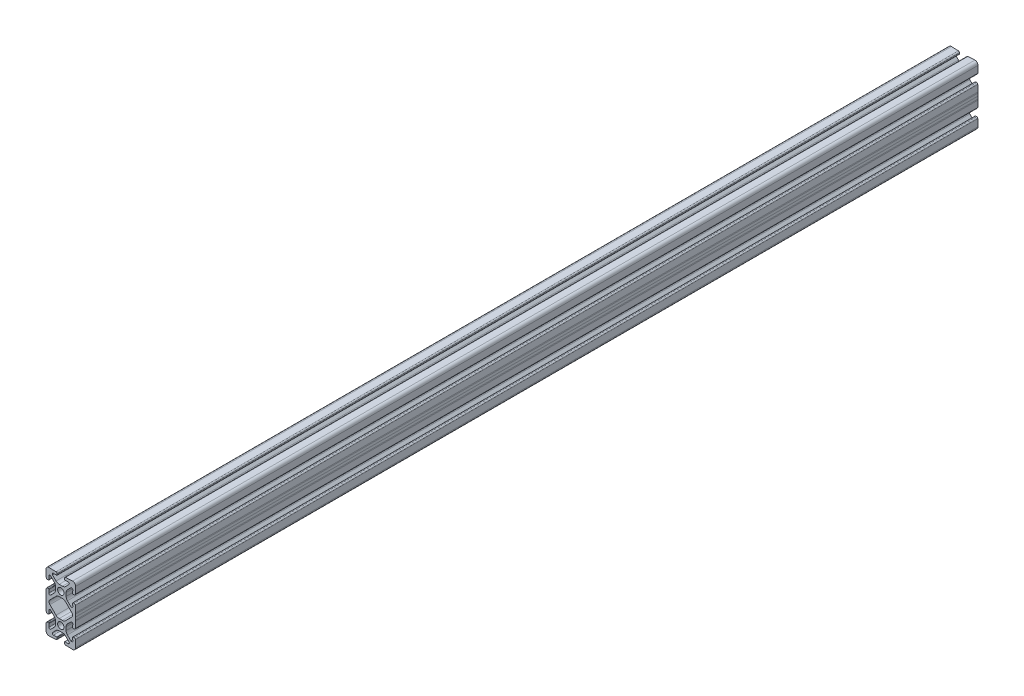
from build123d import *

# Parameters (mm, degrees)
SKETCH3_R           = 2.15
BOSS_EXTRUDE1_DEPTH = 304.8
CIRPATTERN1_COUNT   = 2


with BuildPart() as part:
    # Sketch3 → Boss-Extrude1 (new, symmetric)
    with BuildSketch(Plane.XY):
        with BuildLine():
            Line((-8.30911066, 7.475083014), (-9.008684239, 7.499512662))
            ThreePointArc((-9.008684239, 7.499512662), (-9.582202525, 7.285082961), (-9.836116498, 6.727919597))
            Line((-9.836116498, 6.727919597), (-9.986803685, 2.412803152))
            ThreePointArc((-9.986803685, 2.412803152), (-9.995837451, 2.069746735), (-9.99898368, 1.726585818))
            Line((-9.99898368, 1.726585818), (-10, 0))
            Line((-10, 0), (-7.916458339, 0))
            ThreePointArc((-7.916458339, 0), (-7.764217404, 0.765366865), (-7.330671901, 1.414213562))
            Line((-7.330671901, 1.414213562), (-3.22356512, 5.521320344))
            ThreePointArc((-3.22356512, 5.521320344), (-2.250295073, 6.171638598), (-1.102244776, 6.4))
            Line((-1.102244776, 6.4), (1.102244776, 6.4))
            ThreePointArc((1.102244776, 6.4), (2.250295073, 6.171638598), (3.22356512, 5.521320344))
            Line((3.22356512, 5.521320344), (7.330671901, 1.414213562))
            ThreePointArc((7.330671901, 1.414213562), (7.764217404, 0.765366865), (7.916458339, 0))
            Line((7.916458339, 0), (10, 0))
            Line((10, 0), (9.99898368, 1.726585818))
            ThreePointArc((9.99898368, 1.726585818), (9.995837451, 2.069746735), (9.986803685, 2.412803152))
            Line((9.986803685, 2.412803152), (9.836116498, 6.727919597))
            ThreePointArc((9.836116498, 6.727919597), (9.582202525, 7.285082961), (9.008684239, 7.499512662))
            Line((9.008684239, 7.499512662), (8.30911066, 7.475083014))
            ThreePointArc((8.30911066, 7.475083014), (8.100174399, 7.379865274), (8.019763261, 7.164795917))
            Line((8.019763261, 7.164795917), (8.093719461, 5.046967452))
            ThreePointArc((8.093719461, 5.046967452), (7.631170264, 4.313871343), (6.779559917, 4.47555462))
            Line((6.779559917, 4.47555462), (4.478679656, 6.77643488))
            ThreePointArc((4.478679656, 6.77643488), (3.828361402, 7.749704927), (3.6, 8.897755224))
            Line((3.6, 8.897755224), (3.6, 11.102244776))
            ThreePointArc((3.6, 11.102244776), (3.828361402, 12.250295073), (4.478679656, 13.22356512))
            Line((4.478679656, 13.22356512), (6.779559917, 15.52444538))
            ThreePointArc((6.779559917, 15.52444538), (7.631170264, 15.686128657), (8.093719461, 14.953032548))
            Line((8.093719461, 14.953032548), (8.019763261, 12.835204083))
            ThreePointArc((8.019763261, 12.835204083), (8.100174399, 12.620134726), (8.30911066, 12.524916986))
            Line((8.30911066, 12.524916986), (9.008684239, 12.500487338))
            ThreePointArc((9.008684239, 12.500487338), (9.582202525, 12.714917039), (9.836116498, 13.272080403))
            Line((9.836116498, 13.272080403), (9.998781654, 17.930201007))
            ThreePointArc((9.998781654, 17.930201007), (9.414213562, 19.414213562), (7.930201007, 19.998781654))
            Line((7.930201007, 19.998781654), (3.272080403, 19.836116498))
            ThreePointArc((3.272080403, 19.836116498), (2.714917039, 19.582202525), (2.500487338, 19.008684239))
            Line((2.500487338, 19.008684239), (2.524916986, 18.30911066))
            ThreePointArc((2.524916986, 18.30911066), (2.620134726, 18.100174399), (2.835204083, 18.019763261))
            Line((2.835204083, 18.019763261), (4.953032548, 18.093719461))
            ThreePointArc((4.953032548, 18.093719461), (5.686128657, 17.631170264), (5.52444538, 16.779559917))
            Line((5.52444538, 16.779559917), (3.22356512, 14.478679656))
            ThreePointArc((3.22356512, 14.478679656), (2.250295073, 13.828361402), (1.102244776, 13.6))
            Line((1.102244776, 13.6), (-1.102244776, 13.6))
            ThreePointArc((-1.102244776, 13.6), (-2.250295073, 13.828361402), (-3.22356512, 14.478679656))
            Line((-3.22356512, 14.478679656), (-5.52444538, 16.779559917))
            ThreePointArc((-5.52444538, 16.779559917), (-5.686128657, 17.631170264), (-4.953032548, 18.093719461))
            Line((-4.953032548, 18.093719461), (-2.835204083, 18.019763261))
            ThreePointArc((-2.835204083, 18.019763261), (-2.620134726, 18.100174399), (-2.524916986, 18.30911066))
            Line((-2.524916986, 18.30911066), (-2.500487338, 19.008684239))
            ThreePointArc((-2.500487338, 19.008684239), (-2.714917039, 19.582202525), (-3.272080403, 19.836116498))
            Line((-3.272080403, 19.836116498), (-7.930201007, 19.998781654))
            ThreePointArc((-7.930201007, 19.998781654), (-9.414213562, 19.414213562), (-9.998781654, 17.930201007))
            Line((-9.998781654, 17.930201007), (-9.836116498, 13.272080403))
            ThreePointArc((-9.836116498, 13.272080403), (-9.582202525, 12.714917039), (-9.008684239, 12.500487338))
            Line((-9.008684239, 12.500487338), (-8.30911066, 12.524916986))
            ThreePointArc((-8.30911066, 12.524916986), (-8.100174399, 12.620134726), (-8.019763261, 12.835204083))
            Line((-8.019763261, 12.835204083), (-8.093719461, 14.953032548))
            ThreePointArc((-8.093719461, 14.953032548), (-7.631170264, 15.686128657), (-6.779559917, 15.52444538))
            Line((-6.779559917, 15.52444538), (-4.478679656, 13.22356512))
            ThreePointArc((-4.478679656, 13.22356512), (-3.828361402, 12.250295073), (-3.6, 11.102244776))
            Line((-3.6, 11.102244776), (-3.6, 8.897755224))
            ThreePointArc((-3.6, 8.897755224), (-3.828361402, 7.749704927), (-4.478679656, 6.77643488))
            Line((-4.478679656, 6.77643488), (-6.779559917, 4.47555462))
            ThreePointArc((-6.779559917, 4.47555462), (-7.631170264, 4.313871343), (-8.093719461, 5.046967452))
            Line((-8.093719461, 5.046967452), (-8.019763261, 7.164795917))
            ThreePointArc((-8.019763261, 7.164795917), (-8.100174399, 7.379865274), (-8.30911066, 7.475083014))
        make_face()
        with Locations(Location((0, 10, 0), (0, 0, 180))):
            Circle(SKETCH3_R, mode=Mode.SUBTRACT)
    boss_extrude1 = extrude(amount=BOSS_EXTRUDE1_DEPTH, both=True)

    # CirPattern1: Boss-Extrude1 ×2 about axis
    cirpattern1_axis = Axis((0, 0, 0), (0, 0, 1))
    for i in range(1, CIRPATTERN1_COUNT):
        add(boss_extrude1.rotate(cirpattern1_axis, i * 360 / CIRPATTERN1_COUNT))


solid = part.part
